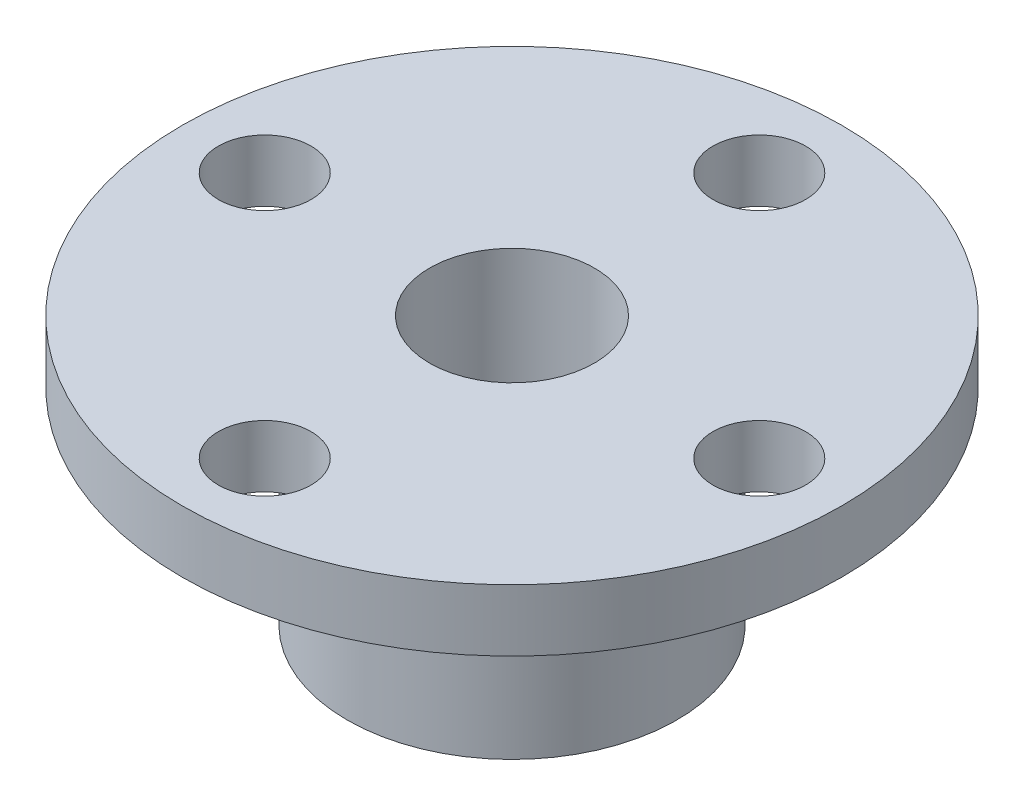
from build123d import *

# Parameters (mm, degrees)
SKETCH1_R                  = 8
SKETCH1_R_2                = 4
BOSS_EXTRUDE1_DEPTH        = 5
SKETCH2_R                  = 16
SKETCH2_R_2                = 4
BOSS_EXTRUDE2_DEPTH        = 3
M4X0_7_TAPPED_HOLE1_REACH  = 31.933
M4X0_7_TAPPED_HOLE1_BORE_R = 1.65
M4_CLEARANCE_HOLE1_D       = 4.5


with BuildPart() as part:
    # Sketch1 → Boss-Extrude1 (new, symmetric)
    with BuildSketch(Plane(origin=(0, 0, 0), x_dir=(1, 0, 0), z_dir=(0, 1, 0))):
        with Locations(Location((0, 0, 0), (0, 0, 270))):
            Circle(SKETCH1_R)
        with Locations(Location((0, 0, 0), (0, 0, 270))):
            Circle(SKETCH1_R_2, mode=Mode.SUBTRACT)
    extrude(amount=BOSS_EXTRUDE1_DEPTH, both=True)

    # Sketch2 → Boss-Extrude2 (add)
    with BuildSketch(Plane(origin=(0, 5, 0), x_dir=(1, 0, 0), z_dir=(0, 1, 0))):
        with Locations(Location((0, 0, 0), (0, 0, 270))):
            Circle(SKETCH2_R)
        with Locations(Location((0, 0, 0), (0, 0, 270))):
            Circle(SKETCH2_R_2, mode=Mode.SUBTRACT)
    extrude(amount=BOSS_EXTRUDE2_DEPTH)

    # M4x0.7 Tapped Hole1 bore → M4x0.7 Tapped Hole1 (cut, up to next)
    with BuildSketch(Plane.ZY.offset(8), mode=Mode.PRIVATE) as m4x0_7_tapped_hole1_sk1:
        Circle(M4X0_7_TAPPED_HOLE1_BORE_R)
    m4x0_7_tapped_hole1_tool1 = extrude(m4x0_7_tapped_hole1_sk1.sketch, amount=-M4X0_7_TAPPED_HOLE1_REACH, mode=Mode.PRIVATE) & part.part
    add(m4x0_7_tapped_hole1_tool1.solids().sort_by_distance((-8, 0, 0))[0], mode=Mode.SUBTRACT)

    # M4 Clearance Hole1 (through all)
    with Locations(Plane(origin=(0, 8, 0), x_dir=(1, 0, 0), z_dir=(0, 1, 0))):
        with Locations((0, 12), (12, 0), (-12, 0), (0, -12)):
            Hole(M4_CLEARANCE_HOLE1_D / 2)


solid = part.part
